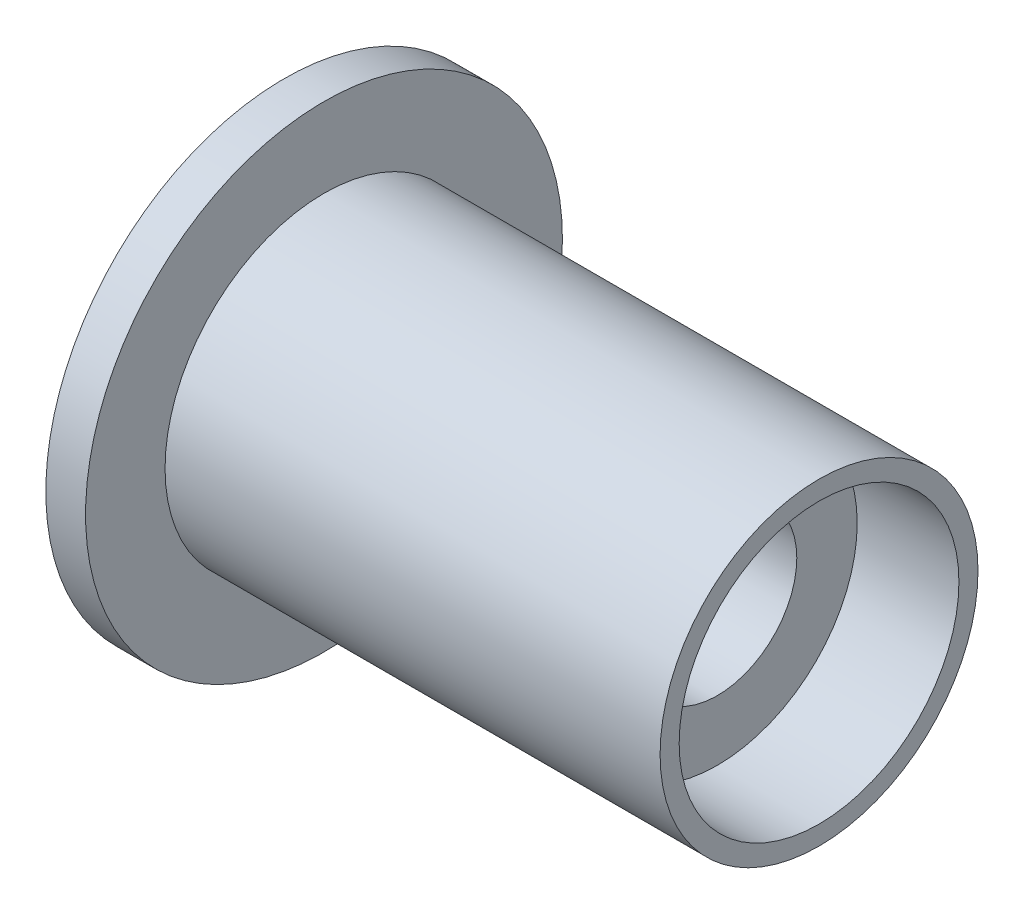
from build123d import *


with BuildPart() as part:
    # Sketch1 → Revolve1 (revolve)
    with BuildSketch(Plane.XY, mode=Mode.PRIVATE) as revolve1_sk:
        Polygon((0, 9.525), (0, 3.175), (17.29994, 3.175), (17.29994, 5.588), (21.36394, 5.588), (21.36394, 6.35), (1.5875, 6.35), (1.5875, 9.525), align=None)
    revolve(revolve1_sk.sketch.rotate(Axis((21.36394, 0, 0), (-1, 0, 0)), 90), axis=Axis((21.36394, 0, 0), (-1, 0, 0)))


solid = part.part
